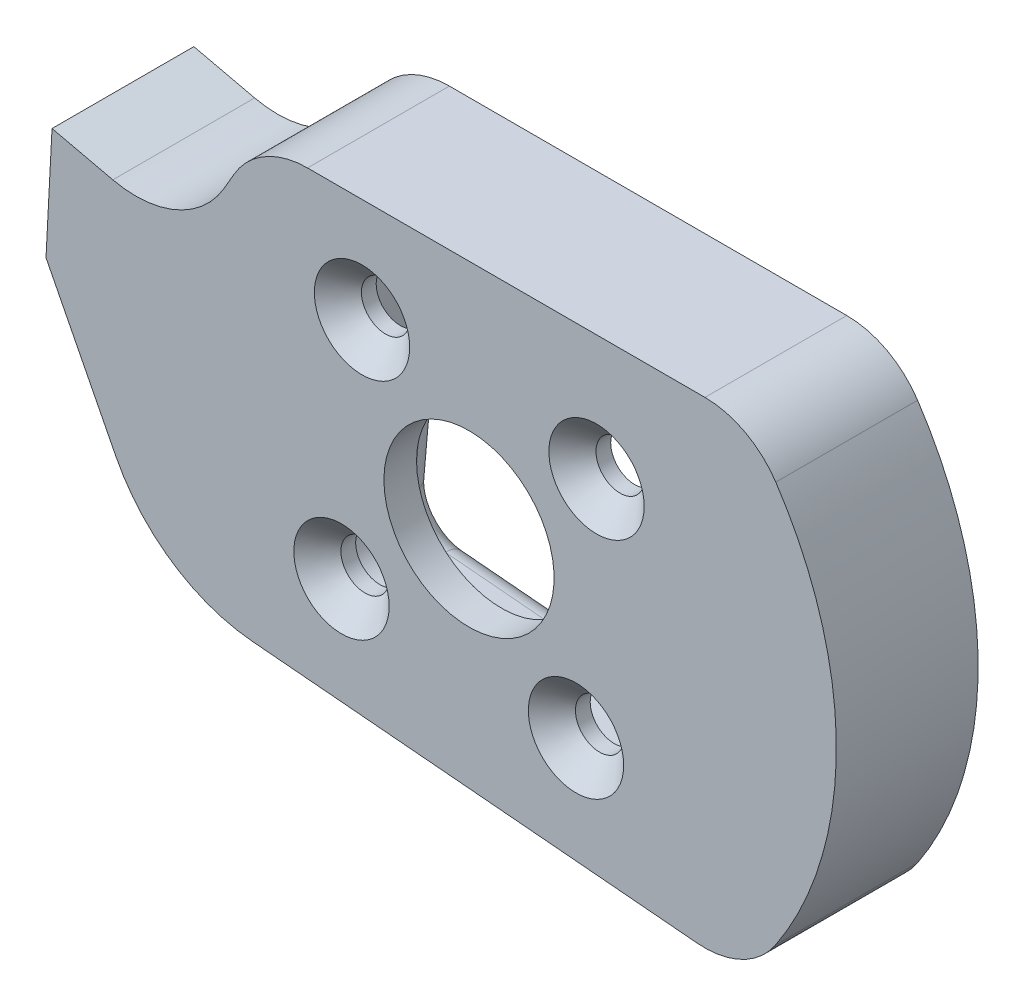
from build123d import *

# Parameters (mm, degrees)
EXTRUS_O_PRINCIPAL_DEPTH                            = 50
REBAIXO_CAMISA_DEPTH                                = 36.5
FILETE_ALIVIO_REBAIXO_R                             = 8
ESBO_O2_3_R                                         = 30
FURO_EIXO_DEPTH                                     = 181.048651344
CORTE_EXTRUS_O1_START                               = -36.5
ESBO_O2_4_R                                         = 37.5
CORTE_EXTRUS_O1_DEPTH                               = 2
ESCAREADO_PARA_PARAFUSO_ALLEN_SEXTAVADO_D           = 17
ESCAREADO_PARA_PARAFUSO_ALLEN_SEXTAVADO_CSINK_D     = 33.6
ESCAREADO_PARA_PARAFUSO_ALLEN_SEXTAVADO_CSINK_ANGLE = 90


with BuildPart() as part:
    # Sketch2 → EXTRUSÃO PRINCIPAL (new body)
    with BuildSketch(Plane.XY):
        with BuildLine():
            Line((-127.578119637, 46.051076804), (-149.014261062, 51))
            Line((-149.014261062, 51), (-151.136776123, 10.5))
            Line((-151.136776123, 10.5), (-126.552927997, -37.748518598))
            ThreePointArc((-126.552927997, -37.748518598), (-106.644110754, -60.251342967), (-78.321881111, -70.280770499))
            Line((-78.321881111, -70.280770499), (78.489629635, -84))
            ThreePointArc((78.489629635, -84), (94.087674002, -81.159159507), (106.059471738, -70.764669536))
            ThreePointArc((106.059471738, -70.764669536), (127.499968454, -0.089689786), (106.158925464, 70.615384615))
            ThreePointArc((106.158925464, 70.615384615), (95.349660705, 80.44297202), (81.180354766, 84))
            Line((81.180354766, 84), (-58.932234692, 84))
            ThreePointArc((-58.932234692, 84), (-73.932234692, 79.980762114), (-84.912996806, 69))
            Line((-84.912996806, 69), (-88.302967145, 63.128399137))
            ThreePointArc((-88.302967145, 63.128399137), (-105.1249152, 48.114236459), (-127.578119637, 46.051076804))
        make_face()
    extrude(amount=EXTRUS_O_PRINCIPAL_DEPTH)

    # Esboço2 → REBAIXO CAMISA (cut)
    with BuildSketch(Plane(origin=(0, 0, 0), x_dir=(-1, 0, 0), z_dir=(0, 0, -1))):
        with BuildLine():
            Line((-48.331774145, 55.581801869), (42.321943382, 63.512974459))
            ThreePointArc((42.321943382, 63.512974459), (51.081263611, 60.751171399), (55.322148672, 52.604506995))
            Line((55.322148672, 52.604506995), (63.253321262, -38.049210532))
            ThreePointArc((63.253321262, -38.049210532), (60.491518202, -46.808530761), (52.344853798, -51.049415822))
            Line((52.344853798, -51.049415822), (-38.308863729, -58.980588412))
            ThreePointArc((-38.308863729, -58.980588412), (-47.068183958, -56.218785352), (-51.309069019, -48.072120948))
            Line((-51.309069019, -48.072120948), (-59.240241609, 42.581596579))
            ThreePointArc((-59.240241609, 42.581596579), (-56.478438549, 51.340916808), (-48.331774145, 55.581801869))
        make_face()
    extrude(amount=-REBAIXO_CAMISA_DEPTH, mode=Mode.SUBTRACT)

    # FILETE ALIVIO REBAIXO
    filete_alivio_rebaixo_edges = [part.edges().sort_by_distance(p)[0] for p in [
        (3.004915382, 59.547388164, 0),
        (-51.081263611, 60.751171399, 0),
        (-59.287734967, 7.277648231, 0),
        (56.478438549, 51.340916808, 0),
        (55.274655314, -2.745262185, 0),
        (47.068183958, -56.218785352, 0),
        (-7.017995034, -55.015002117, 0),
        (-60.491518202, -46.808530761, 0),
    ]]
    fillet(filete_alivio_rebaixo_edges, radius=FILETE_ALIVIO_REBAIXO_R)

    # Esboço2<3> → FURO EIXO (cut, through all)
    with BuildSketch(Plane(origin=(0, 0, 0), x_dir=(-1, 0, 0), z_dir=(0, 0, -1))):
        with Locations((2.006539826, 2.266193023)):
            Circle(ESBO_O2_3_R)
    extrude(amount=-FURO_EIXO_DEPTH, mode=Mode.SUBTRACT)

    # Esboço2<4> → Corte-extrusão1 (cut)
    with BuildSketch(Plane(origin=(0, 0, 0), x_dir=(-1, 0, 0), z_dir=(0, 0, -1)).offset(CORTE_EXTRUS_O1_START)):
        with Locations((2.006539826, 2.266193023)):
            Circle(ESBO_O2_4_R)
    extrude(amount=-CORTE_EXTRUS_O1_DEPTH, mode=Mode.SUBTRACT)

    # Escareado para parafuso Allen sextavado escareado de M161 (through all)
    with Locations(Plane.XY.offset(50)):
        with Locations((-39.731656473, 47.225236318), (42.952503468, 39.99130967), (-46.965583121, -35.458923623), (35.71857682, -42.692850271)):
            CounterSinkHole(ESCAREADO_PARA_PARAFUSO_ALLEN_SEXTAVADO_D / 2, ESCAREADO_PARA_PARAFUSO_ALLEN_SEXTAVADO_CSINK_D / 2, counter_sink_angle=ESCAREADO_PARA_PARAFUSO_ALLEN_SEXTAVADO_CSINK_ANGLE)


solid = part.part
